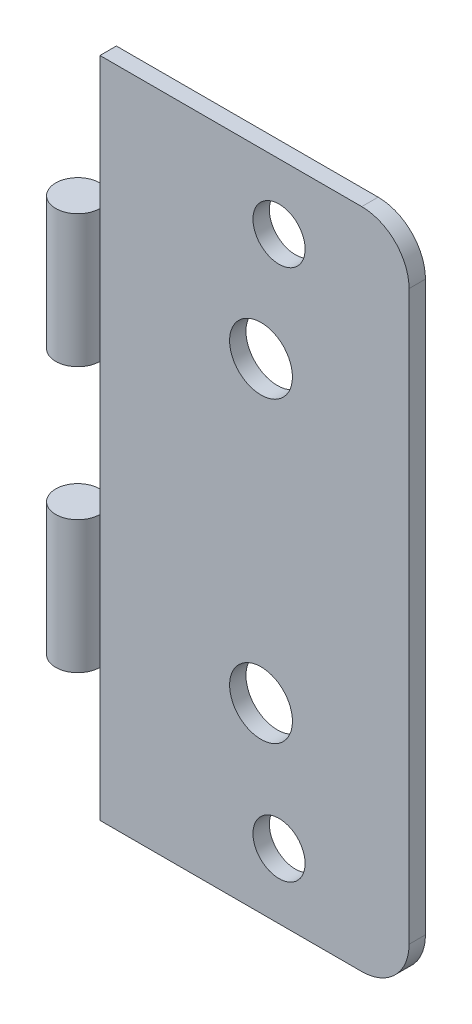
from build123d import *

# Parameters (mm, degrees)
SKETCH1_R                = 2.97
SKETCH1_W                = 44.45
SKETCH1_H                = 2.2
BOSS_EXTRUDE1_DEPTH      = 44.45
CUT_EXTRUDE1_DEPTH       = 63.931914797
CUT_EXTRUDE1_DEPTH_BACK  = 63.931914797
SKETCH2_W                = 5.94
SKETCH2_H                = 17.78
FILLET1_R                = 6.35
SKETCH4_R                = 3.5
CUT_EXTRUDE2_DEPTH       = 63.931914797
F_5_16_CLEARANCE_HOLE1_D = 8.4328


with BuildPart() as part:
    # Sketch1 → Boss-Extrude1 (new, symmetric)
    with BuildSketch(Plane(origin=(0, 0, 0), x_dir=(1, 0, 0), z_dir=(0, 1, 0))):
        Circle(SKETCH1_R)
        with Locations((22.225, 1.1)):
            Rectangle(SKETCH1_W, SKETCH1_H)
    extrude(amount=BOSS_EXTRUDE1_DEPTH, both=True)

    # Sketch2 → Cut-Extrude1 (cut, two sides: drawn at the far end of the back side and taken through both)
    with BuildSketch(Plane.XY.offset(-CUT_EXTRUDE1_DEPTH_BACK)):
        with Locations((0, 35.56)):
            Rectangle(SKETCH2_W, SKETCH2_H)
        Rectangle(SKETCH2_W, SKETCH2_H)
        with Locations((0, -35.56)):
            Rectangle(SKETCH2_W, SKETCH2_H)
    extrude(amount=CUT_EXTRUDE1_DEPTH + CUT_EXTRUDE1_DEPTH_BACK, mode=Mode.SUBTRACT)

    # Fillet1
    fillet1_edges = [part.edges().sort_by_distance(p)[0] for p in [
        (44.45, 44.45, -1.1),
        (44.45, -44.45, -1.1),
    ]]
    fillet(fillet1_edges, radius=FILLET1_R)

    # Sketch4 → Cut-Extrude2 (cut, through all)
    with BuildSketch(Plane.XY):
        with Locations((27, 35.7)):
            Circle(SKETCH4_R)
        with Locations((27, -35.7)):
            Circle(SKETCH4_R)
    extrude(amount=-CUT_EXTRUDE2_DEPTH, mode=Mode.SUBTRACT)

    # 5/16 Clearance Hole1 (through all)
    with Locations(Plane.XY):
        with Locations((24.58125, 20.010345019), (24.58125, -20.010345019)):
            Hole(F_5_16_CLEARANCE_HOLE1_D / 2)


solid = part.part
